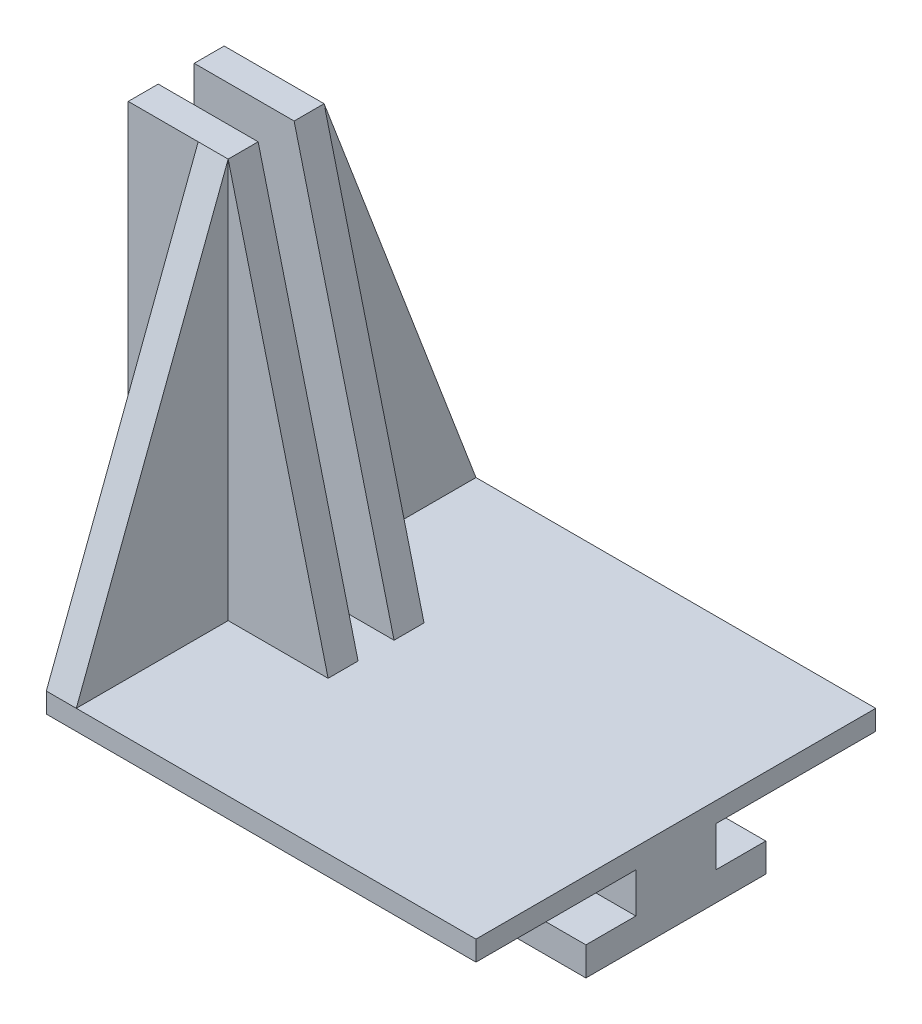
from build123d import *

# Parameters (mm, degrees)
SKETCH1_W                = 20
SKETCH1_H                = 20
BOSS_EXTRUDE1_DEPTH      = 1
BOSS_EXTRUDE5_DEPTH      = 20
BOSS_EXTRUDE6_DEPTH      = 5
BOSS_EXTRUDE6_DEPTH_BACK = 5
SKETCH5_W                = 1.5
SKETCH5_H                = 20
CUT_EXTRUDE1_DEPTH       = 5
BOSS_EXTRUDE7_DEPTH      = 1.5


with BuildPart() as part:
    # Sketch1 → Boss-Extrude1 (new body)
    with BuildSketch(Plane(origin=(0, 0, 0), x_dir=(1, 0, 0), z_dir=(0, 1, 0))):
        Rectangle(SKETCH1_W, SKETCH1_H)
    extrude(amount=BOSS_EXTRUDE1_DEPTH)

    # Sketch4 → Boss-Extrude5 (add)
    with BuildSketch(Plane(origin=(10, 0, 0), x_dir=(0, 0, -1), z_dir=(1, 0, 0))):
        Polygon((-2, 0), (-2, -2), (-4.5, -2), (-4.5, -3.436102186), (4.5, -3.436102186), (4.5, -2), (2, -2), (2, 0), align=None)
    extrude(amount=-BOSS_EXTRUDE5_DEPTH)



with BuildPart() as body_2:
    # Sketch5 → Boss-Extrude6 (new, two sides: drawn at the far end of the back side and taken through both)
    with BuildSketch(Plane.ZY.offset(10).offset(-BOSS_EXTRUDE6_DEPTH_BACK)):
        with Locations((-1.65, 11)):
            Rectangle(SKETCH5_W, SKETCH5_H)
    extrude(amount=BOSS_EXTRUDE6_DEPTH + BOSS_EXTRUDE6_DEPTH_BACK)

    # Sketch6 → Cut-Extrude1 (cut)
    with BuildSketch(Plane.XY.offset(-0.9)):
        Polygon((-5, 1), (-10, 21), (-5, 21), align=None)
    extrude(amount=-CUT_EXTRUDE1_DEPTH, mode=Mode.SUBTRACT)


with BuildPart() as part_1:
    add(part.part)

    add(body_2.part)  # Boss-Extrude7 merges body 2
    # Sketch5<3> → Boss-Extrude7 (add)
    with BuildSketch(Plane.ZY.offset(10)):
        Polygon((-0.9, 0), (-0.9, 1), (-2.4, 1), (-2.4, 21), (-10, 1), (-10, 0), align=None)
    extrude(amount=BOSS_EXTRUDE7_DEPTH)

    # Mirror5: part across plane


with BuildPart() as part_2:
    add(part_1.part)
    add(part_1.part.mirror(Plane.XY))


solid = part_2.part
